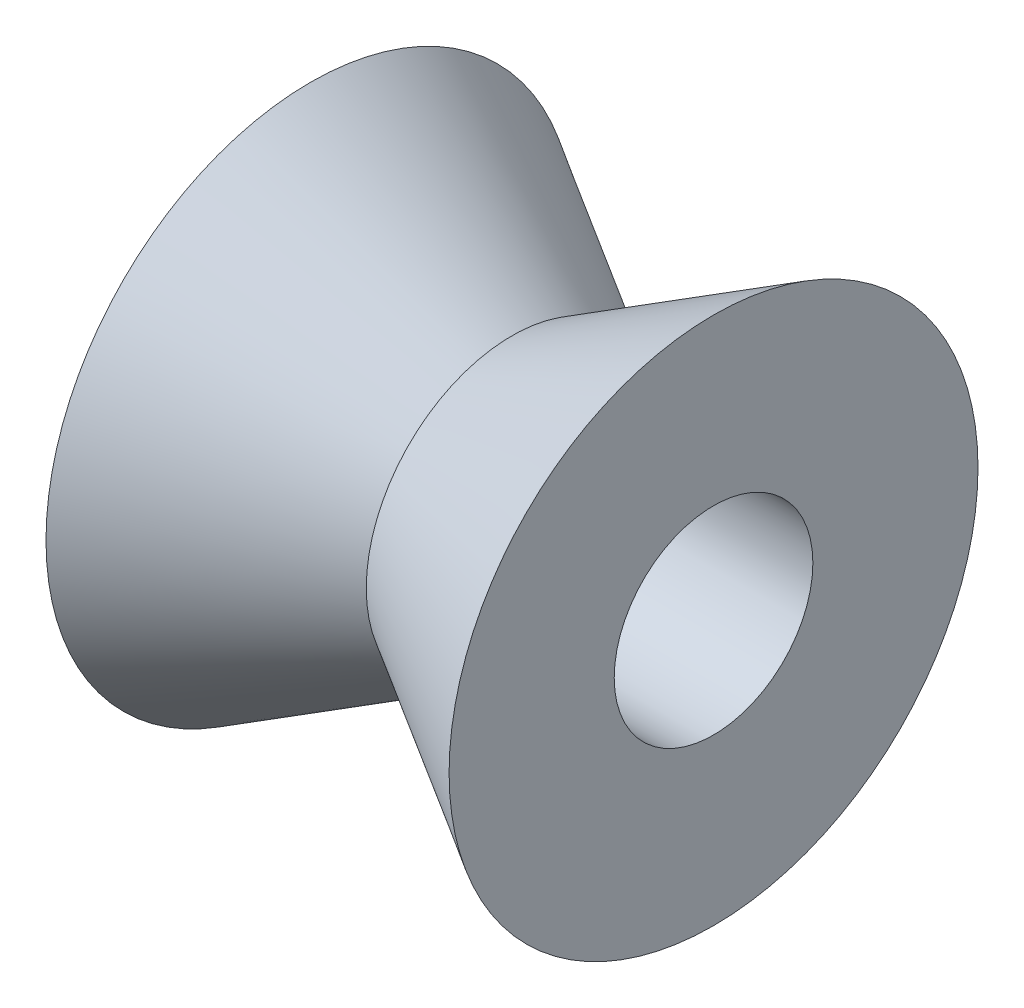
from build123d import *


with BuildPart() as part:
    # Sketch1 → Revolve2 (revolve)
    with BuildSketch(Plane(origin=(0, 0, 0), x_dir=(1, 0, 0), z_dir=(0, 1, 0))):
        Polygon((-4.639913961, 6.123399444), (-4.639913961, 2.3), (4.693419373, 2.3), (4.693419373, 6.123399444), (0.026752706, 3.374731981), align=None)
    revolve(axis=Axis((-4.639913961, 0, 0), (1, 0, 0)))


solid = part.part
